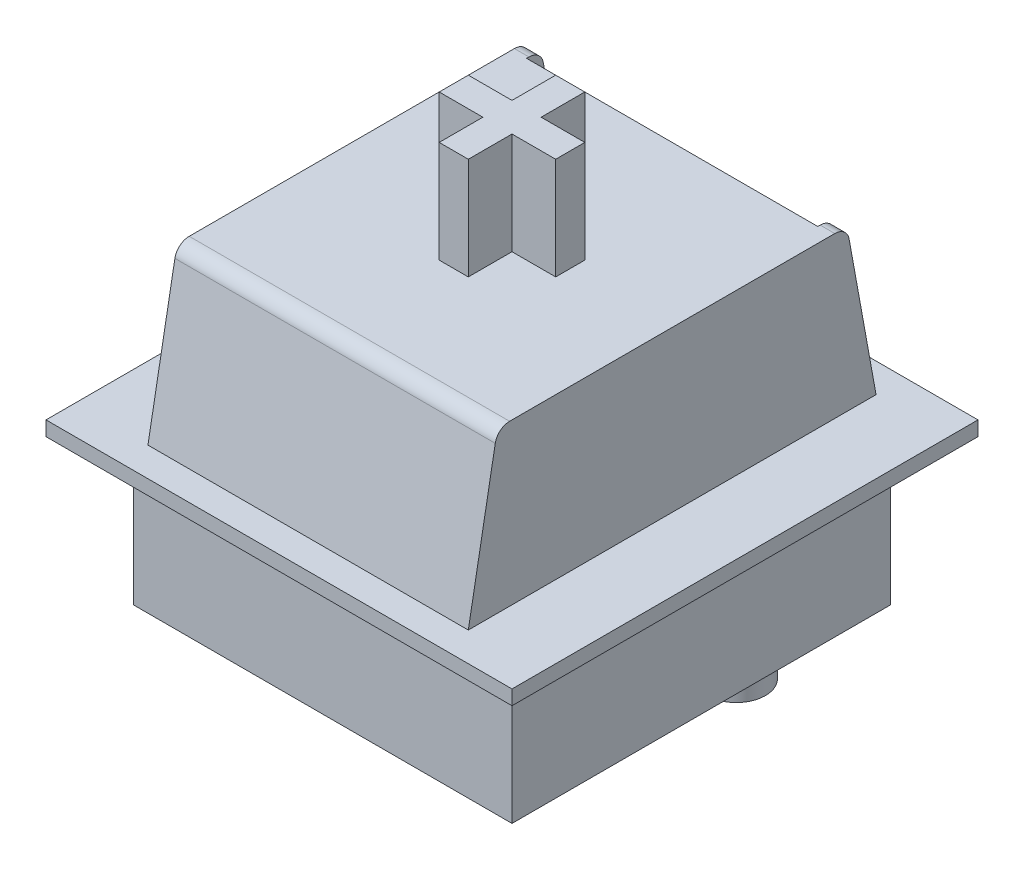
from build123d import *

# Parameters (mm, degrees)
SKETCH2_W           = 16
SKETCH2_H           = 16
BOSS_EXTRUDE1_DEPTH = 11
SKETCH3_R           = 1.5
BOSS_EXTRUDE2_DEPTH = 3
SKETCH4_W           = 16
SKETCH4_H           = 16
SKETCH4_W_2         = 13
SKETCH4_H_2         = 13
CUT_EXTRUDE1_DEPTH  = 5
BOSS_EXTRUDE3_DEPTH = 3.5
SKETCH6_W           = 16
SKETCH6_H           = 16
SKETCH6_W_2         = 11
SKETCH6_H_2         = 11
CUT_EXTRUDE2_DEPTH  = 5.5
BOSS_EXTRUDE4_DEPTH = 0.5
BOSS_EXTRUDE5_START = -0.5
BOSS_EXTRUDE5_DEPTH = 0.5
BOSS_EXTRUDE6_DEPTH = 11
SKETCH10_R          = 1
BOSS_EXTRUDE7_DEPTH = 3.5


with BuildPart() as part:
    # Sketch2 → Boss-Extrude1 (new body)
    with BuildSketch(Plane(origin=(0, 0, 0), x_dir=(1, 0, 0), z_dir=(0, 1, 0))):
        with Locations((8, 8)):
            Rectangle(SKETCH2_W, SKETCH2_H)
    extrude(amount=BOSS_EXTRUDE1_DEPTH)

    # Sketch3 → Boss-Extrude2 (add)
    with BuildSketch(Plane.XZ):
        with Locations(Location((8, -8, 0), (0, 0, 270))):
            Circle(SKETCH3_R)
    extrude(amount=BOSS_EXTRUDE2_DEPTH)

    # Sketch4 → Cut-Extrude1 (cut)
    with BuildSketch(Plane.XZ):
        with Locations((8, -8)):
            Rectangle(SKETCH4_W, SKETCH4_H)
        with Locations((8, -8)):
            Rectangle(SKETCH4_W_2, SKETCH4_H_2, mode=Mode.SUBTRACT)
    extrude(amount=-CUT_EXTRUDE1_DEPTH, mode=Mode.SUBTRACT)

    # Sketch5 → Boss-Extrude3 (add)
    with BuildSketch(Plane(origin=(0, 11, 0), x_dir=(1, 0, 0), z_dir=(0, 1, 0))):
        Polygon((7.5, 10), (7.5, 8.5), (6, 8.5), (6, 7.5), (7.5, 7.5), (7.5, 6), (8.5, 6), (8.5, 7.5), (10, 7.5), (10, 8.5), (8.5, 8.5), (8.5, 10), align=None)
    extrude(amount=BOSS_EXTRUDE3_DEPTH)

    # Sketch6 → Cut-Extrude2 (cut)
    with BuildSketch(Plane(origin=(0, 11, 0), x_dir=(1, 0, 0), z_dir=(0, 1, 0))):
        with Locations((8, 8)):
            Rectangle(SKETCH6_W, SKETCH6_H)
        with Locations((8, 8)):
            Rectangle(SKETCH6_W_2, SKETCH6_H_2, mode=Mode.SUBTRACT)
    extrude(amount=-CUT_EXTRUDE2_DEPTH, mode=Mode.SUBTRACT)

    # Sketch7 → Boss-Extrude4 (add)
    with BuildSketch(Plane.ZY.offset(-2.5)):
        with BuildLine():
            Line((-13.5, 11), (-13.582711823, 11))
            ThreePointArc((-13.582711823, 11), (-13.903085543, 10.883875865), (-14.074646778, 10.589442719))
            Line((-14.074646778, 10.589442719), (-15, 5.5))
            Line((-15, 5.5), (-13.5, 5.5))
            Line((-13.5, 5.5), (-13.5, 11))
        make_face()
    extrude(amount=-BOSS_EXTRUDE4_DEPTH)

    # Sketch8 → Boss-Extrude5 (add)
    with BuildSketch(Plane(origin=(13.5, 0, 0), x_dir=(0, 0, -1), z_dir=(1, 0, 0)).offset(BOSS_EXTRUDE5_START)):
        with BuildLine():
            Line((15, 5.5), (13.5, 5.5))
            Line((13.5, 5.5), (13.5, 11))
            Line((13.5, 11), (13.582711823, 11))
            ThreePointArc((13.582711823, 11), (13.903085543, 10.883875865), (14.074646778, 10.589442719))
            Line((14.074646778, 10.589442719), (15, 5.5))
        make_face()
    extrude(amount=BOSS_EXTRUDE5_DEPTH)

    # Sketch9 → Boss-Extrude6 (add)
    with BuildSketch(Plane.ZY.offset(-2.5)):
        with BuildLine():
            Line((-2.5, 11), (-2.417288177, 11))
            ThreePointArc((-2.417288177, 11), (-2.096914457, 10.883875865), (-1.925353222, 10.589442719))
            Line((-1.925353222, 10.589442719), (-1, 5.5))
            Line((-1, 5.5), (-2.5, 5.5))
            Line((-2.5, 5.5), (-2.5, 11))
        make_face()
    extrude(amount=-BOSS_EXTRUDE6_DEPTH)

    # Sketch10 → Boss-Extrude7 (add)
    with BuildSketch(Plane.XZ):
        with Locations(Location((4.3, -10.65, 0), (0, 0, 270))):
            Circle(SKETCH10_R)
        with Locations(Location((10.55, -13.15, 0), (0, 0, 270))):
            Circle(SKETCH10_R)
    extrude(amount=BOSS_EXTRUDE7_DEPTH)


solid = part.part
